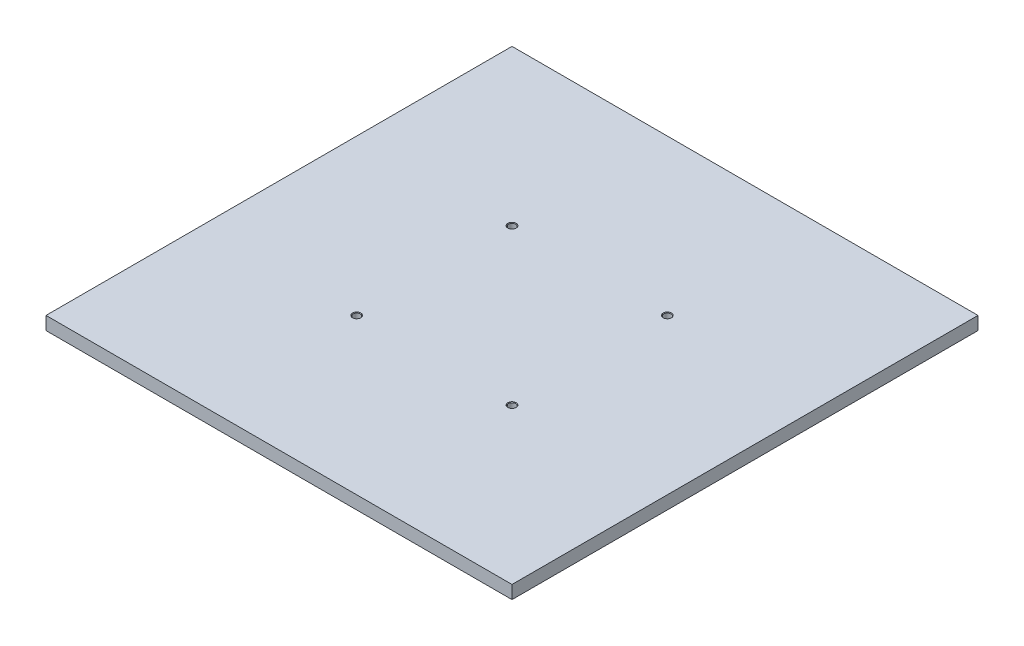
from build123d import *

# Parameters (mm, degrees)
ESBO_O1_W                           = 450
ESBO_O1_H                           = 450
RESSALTO_EXTRUS_O1_DEPTH            = 12.7
FURO_ROSCADO_DE_M8X1_01_D           = 7
FURO_ROSCADO_DE_M8X1_01_CSINK_D     = 8.05
FURO_ROSCADO_DE_M8X1_01_CSINK_ANGLE = 90


with BuildPart() as part:
    # Esboço1 → Ressalto-extrusão1 (new body)
    with BuildSketch(Plane(origin=(0, 0, 0), x_dir=(1, 0, 0), z_dir=(0, 1, 0))):
        Rectangle(ESBO_O1_W, ESBO_O1_H)
    extrude(amount=RESSALTO_EXTRUS_O1_DEPTH)

    # Furo roscado de M8x1.01 (through all)
    with Locations(Plane(origin=(0, 12.7, 0), x_dir=(1, 0, 0), z_dir=(0, 1, 0))):
        with Locations((-75, 75), (75, 75), (75, -75), (-75, -75)):
            CounterSinkHole(FURO_ROSCADO_DE_M8X1_01_D / 2, FURO_ROSCADO_DE_M8X1_01_CSINK_D / 2, counter_sink_angle=FURO_ROSCADO_DE_M8X1_01_CSINK_ANGLE)


solid = part.part
